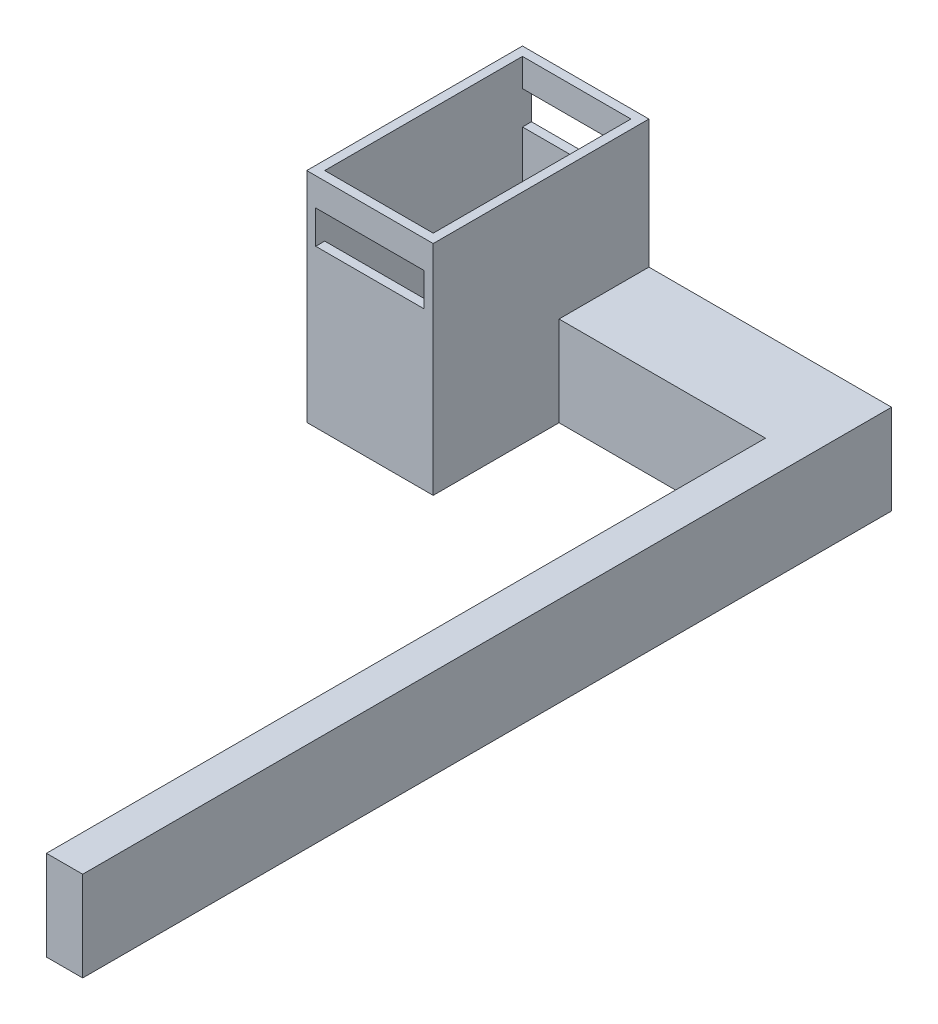
from build123d import *

# Parameters (mm, degrees)
SKETCH1_W               = 14.07
SKETCH1_H               = 24
BOSS_EXTRUDE1_DEPTH     = 24.27
SKETCH3_W               = 12.07
SKETCH3_H               = 22
CUT_EXTRUDE1_DEPTH      = 23.27
CUT_EXTRUDE2_DEPTH      = 37.918800089
CUT_EXTRUDE2_DEPTH_BACK = 37.918800089
SKETCH5_W               = 12.07
SKETCH5_H               = 3.69525946
SKETCH6_W               = 10
SKETCH6_H               = 10
BOSS_EXTRUDE2_DEPTH     = 27
SKETCH7_W               = 4.035
SKETCH7_H               = 10
BOSS_EXTRUDE3_DEPTH     = 80


with BuildPart() as part:
    # Sketch1 → Boss-Extrude1 (new body)
    with BuildSketch(Plane(origin=(0, 0, 0), x_dir=(1, 0, 0), z_dir=(0, 1, 0))):
        with Locations((7.035, 12)):
            Rectangle(SKETCH1_W, SKETCH1_H)
    extrude(amount=BOSS_EXTRUDE1_DEPTH)

    # Sketch3 → Cut-Extrude1 (cut)
    with BuildSketch(Plane(origin=(0, 24.27, 0), x_dir=(1, 0, 0), z_dir=(0, 1, 0))):
        with Locations((7.035, 12)):
            Rectangle(SKETCH3_W, SKETCH3_H)
    extrude(amount=-CUT_EXTRUDE1_DEPTH, mode=Mode.SUBTRACT)

    # Sketch5 → Cut-Extrude2 (cut, two sides: drawn at the far end of the back side and taken through both)
    with BuildSketch(Plane(origin=(0, 0, -24), x_dir=(-1, 0, 0), z_dir=(0, 0, -1)).offset(-CUT_EXTRUDE2_DEPTH_BACK)):
        with Locations((-7.035, 19.31762973)):
            Rectangle(SKETCH5_W, SKETCH5_H)
    extrude(amount=CUT_EXTRUDE2_DEPTH + CUT_EXTRUDE2_DEPTH_BACK, mode=Mode.SUBTRACT)

    # Sketch6 → Boss-Extrude2 (add)
    with BuildSketch(Plane(origin=(14.07, 0, 0), x_dir=(0, 0, -1), z_dir=(1, 0, 0))):
        with Locations((19, 5)):
            Rectangle(SKETCH6_W, SKETCH6_H)
    extrude(amount=BOSS_EXTRUDE2_DEPTH)

    # Sketch7 → Boss-Extrude3 (add)
    with BuildSketch(Plane.XY.offset(-14)):
        with Locations((39.0525, 5)):
            Rectangle(SKETCH7_W, SKETCH7_H)
    extrude(amount=BOSS_EXTRUDE3_DEPTH)


solid = part.part
